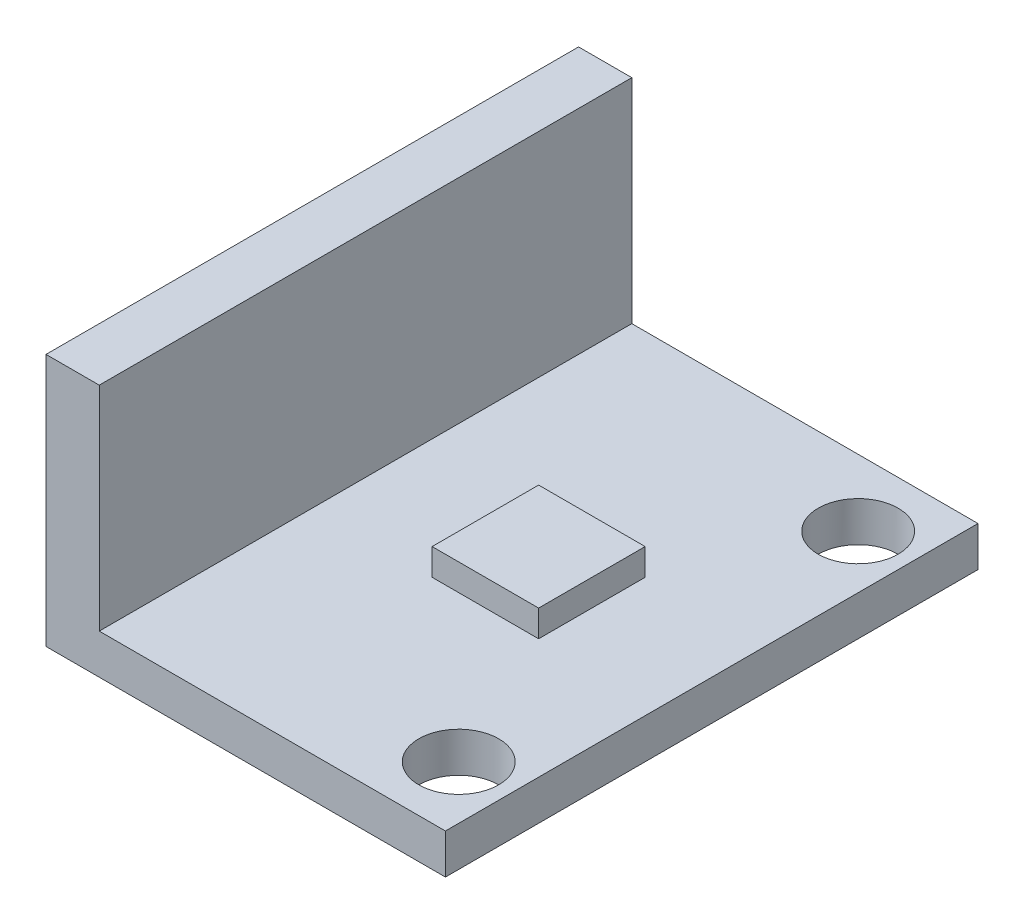
from build123d import *

# Parameters (mm, degrees)
ESQUISSE1_W             = 15
ESQUISSE1_H             = 20
BOSS_EXTRU_1_DEPTH      = 1.5
ENL_V_MAT_EXTRU_1_REACH = 14.59
ESQUISSE2_R             = 1.5
ESQUISSE3_W             = 2
ESQUISSE3_H             = 20
BOSS_EXTRU_2_DEPTH      = 8
ESQUISSE4_W             = 4
ESQUISSE4_H             = 4
BOSS_EXTRU_3_DEPTH      = 1


with BuildPart() as part:
    # Esquisse1 → Boss.-Extru.1 (new body)
    with BuildSketch(Plane(origin=(0, 0, 0), x_dir=(1, 0, 0), z_dir=(0, 1, 0))):
        Rectangle(ESQUISSE1_W, ESQUISSE1_H)
    extrude(amount=BOSS_EXTRU_1_DEPTH)

    # Esquisse2 → Enlèv. mat.-Extru.1 (cut, up to next)
    with BuildSketch(Plane(origin=(0, 1.5, 0), x_dir=(1, 0, 0), z_dir=(0, 1, 0)), mode=Mode.PRIVATE) as enl_v_mat_extru_1_sk1:
        with Locations(Location((5.5, 7.5, 0), (0, 0, 270))):
            Circle(ESQUISSE2_R)
    enl_v_mat_extru_1_tool1 = extrude(enl_v_mat_extru_1_sk1.sketch, amount=-ENL_V_MAT_EXTRU_1_REACH, mode=Mode.PRIVATE) & part.part
    enl_v_mat_extru_1 = enl_v_mat_extru_1_tool1.solids().sort_by_distance((5.5, 1.5, -7.5))[0]
    add(enl_v_mat_extru_1, mode=Mode.SUBTRACT)

    # Symétrie1: Enlèv. mat.-Extru.1 across plane
    add(enl_v_mat_extru_1.mirror(Plane.XY), mode=Mode.SUBTRACT)

    # Esquisse3 → Boss.-Extru.2 (add)
    with BuildSketch(Plane(origin=(0, 1.5, 0), x_dir=(1, 0, 0), z_dir=(0, 1, 0))):
        with Locations((-6.5, 0)):
            Rectangle(ESQUISSE3_W, ESQUISSE3_H)
    extrude(amount=BOSS_EXTRU_2_DEPTH)

    # Esquisse4 → Boss.-Extru.3 (add)
    with BuildSketch(Plane(origin=(0, 1.5, 0), x_dir=(1, 0, 0), z_dir=(0, 1, 0))):
        with Locations((1, 0)):
            Rectangle(ESQUISSE4_W, ESQUISSE4_H)
    extrude(amount=BOSS_EXTRU_3_DEPTH)


solid = part.part
